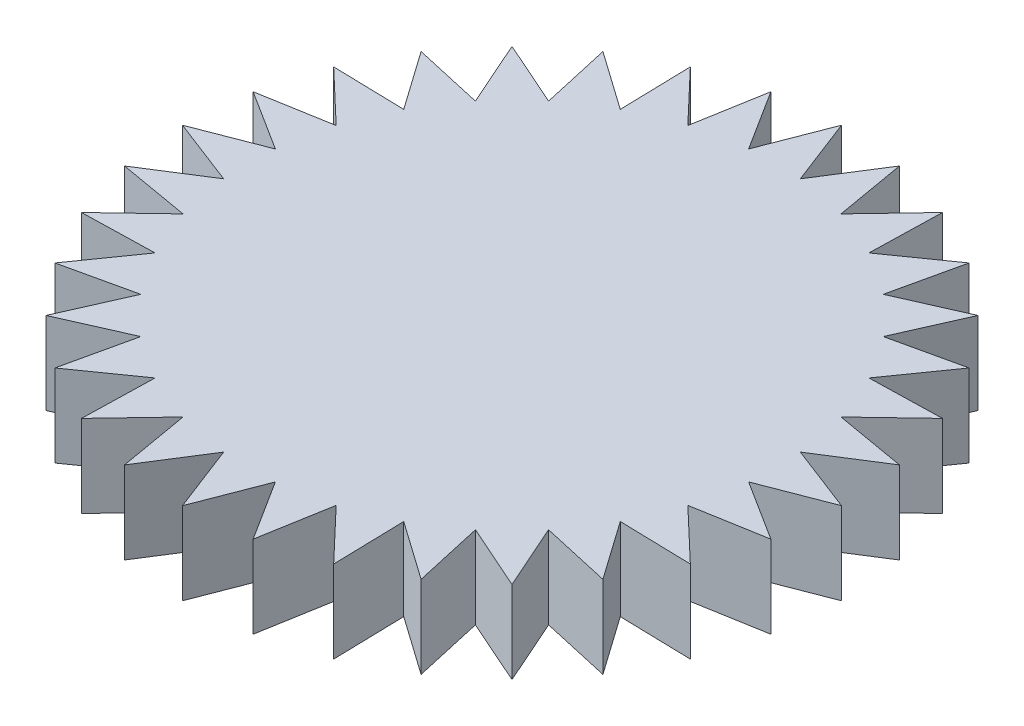
from build123d import *

# Parameters (mm, degrees)
ESQUISSE1_R             = 20
BOSS_EXTRU_1_DEPTH      = 5
ENL_V_START             = -5
ENL_V_MAT_EXTRU_1_DEPTH = 5


with BuildPart() as part:
    # Esquisse1 → Boss.-Extru.1 (new body)
    with BuildSketch(Plane(origin=(0, 0, 0), x_dir=(1, 0, 0), z_dir=(0, 1, 0))):
        with Locations(Location((0, 0, 0), (0, 0, 270))):
            Circle(ESQUISSE1_R)
    extrude(amount=BOSS_EXTRU_1_DEPTH)

    # Esquisse2 → Enlèv. mat.-Extru.1 (cut)
    with BuildSketch(Plane(origin=(0, 5, 0), x_dir=(1, 0, 0), z_dir=(0, 1, 0)).offset(ENL_V_START)):
        with BuildLine():
            Line((-4.64704136, 15.319242341), (-3.90180644, 19.615705608))
            ThreePointArc((-3.90180644, 19.615705608), (-5.805693545, 19.138806715), (-7.653668647, 18.47759065))
            Line((-7.653668647, 18.47759065), (-4.64704136, 15.319242341))
        make_face()
        with BuildLine():
            Line((-1.569113842, 15.931480191), (0, 20))
            ThreePointArc((0, 20), (-1.960342807, 19.903694533), (-3.90180644, 19.615705608))
            Line((-3.90180644, 19.615705608), (-1.569113842, 15.931480191))
        make_face()
        with BuildLine():
            ThreePointArc((3.90180644, 19.615705608), (1.960342807, 19.903694533), (0, 20))
            Line((0, 20), (1.569113842, 15.931480191))
            Line((1.569113842, 15.931480191), (3.90180644, 19.615705608))
        make_face()
        with BuildLine():
            ThreePointArc((7.653668647, 18.47759065), (5.805693545, 19.138806715), (3.90180644, 19.615705608))
            Line((3.90180644, 19.615705608), (4.64704136, 15.319242341))
            Line((4.64704136, 15.319242341), (7.653668647, 18.47759065))
        make_face()
        with BuildLine():
            ThreePointArc((11.11140466, 16.629392246), (9.427934737, 17.638425287), (7.653668647, 18.47759065))
            Line((7.653668647, 18.47759065), (7.546385684, 14.1182946))
            Line((7.546385684, 14.1182946), (11.11140466, 16.629392246))
        make_face()
        with BuildLine():
            ThreePointArc((14.142135624, 14.142135624), (12.687865683, 15.460209067), (11.11140466, 16.629392246))
            Line((11.11140466, 16.629392246), (10.155726639, 12.374788715))
            Line((10.155726639, 12.374788715), (14.142135624, 14.142135624))
        make_face()
        with BuildLine():
            ThreePointArc((16.629392246, 11.11140466), (15.460209067, 12.687865683), (14.142135624, 14.142135624))
            Line((14.142135624, 14.142135624), (12.374788715, 10.155726639))
            Line((12.374788715, 10.155726639), (16.629392246, 11.11140466))
        make_face()
        with BuildLine():
            ThreePointArc((18.47759065, 7.653668647), (17.638425287, 9.427934737), (16.629392246, 11.11140466))
            Line((16.629392246, 11.11140466), (14.1182946, 7.546385684))
            Line((14.1182946, 7.546385684), (18.47759065, 7.653668647))
        make_face()
        with BuildLine():
            ThreePointArc((19.615705608, 3.90180644), (19.138806715, 5.805693545), (18.47759065, 7.653668647))
            Line((18.47759065, 7.653668647), (15.319242341, 4.64704136))
            Line((15.319242341, 4.64704136), (19.615705608, 3.90180644))
        make_face()
        with BuildLine():
            ThreePointArc((20, 0), (19.903694533, 1.960342807), (19.615705608, 3.90180644))
            Line((19.615705608, 3.90180644), (15.931480191, 1.569113842))
            Line((15.931480191, 1.569113842), (20, 0))
        make_face()
        with BuildLine():
            ThreePointArc((19.615705608, -3.90180644), (19.903694533, -1.960342807), (20, 0))
            Line((20, 0), (15.931480191, -1.569113842))
            Line((15.931480191, -1.569113842), (19.615705608, -3.90180644))
        make_face()
        with BuildLine():
            ThreePointArc((18.47759065, -7.653668647), (19.138806715, -5.805693545), (19.615705608, -3.90180644))
            Line((19.615705608, -3.90180644), (15.319242341, -4.64704136))
            Line((15.319242341, -4.64704136), (18.47759065, -7.653668647))
        make_face()
        with BuildLine():
            Line((-7.546385684, 14.1182946), (-7.653668647, 18.47759065))
            ThreePointArc((-7.653668647, 18.47759065), (-9.427934737, 17.638425287), (-11.11140466, 16.629392246))
            Line((-11.11140466, 16.629392246), (-7.546385684, 14.1182946))
        make_face()
        with BuildLine():
            Line((-10.155726639, 12.374788715), (-11.11140466, 16.629392246))
            ThreePointArc((-11.11140466, 16.629392246), (-12.687865683, 15.460209067), (-14.142135624, 14.142135624))
            Line((-14.142135624, 14.142135624), (-10.155726639, 12.374788715))
        make_face()
        with BuildLine():
            Line((-12.374788715, 10.155726639), (-14.142135624, 14.142135624))
            ThreePointArc((-14.142135624, 14.142135624), (-15.460209067, 12.687865683), (-16.629392246, 11.11140466))
            Line((-16.629392246, 11.11140466), (-12.374788715, 10.155726639))
        make_face()
        with BuildLine():
            Line((-14.1182946, 7.546385684), (-16.629392246, 11.11140466))
            ThreePointArc((-16.629392246, 11.11140466), (-17.638425287, 9.427934737), (-18.47759065, 7.653668647))
            Line((-18.47759065, 7.653668647), (-14.1182946, 7.546385684))
        make_face()
        with BuildLine():
            Line((-15.319242341, 4.64704136), (-18.47759065, 7.653668647))
            ThreePointArc((-18.47759065, 7.653668647), (-19.138806715, 5.805693545), (-19.615705608, 3.90180644))
            Line((-19.615705608, 3.90180644), (-15.319242341, 4.64704136))
        make_face()
        with BuildLine():
            Line((-15.931480191, 1.569113842), (-19.615705608, 3.90180644))
            ThreePointArc((-19.615705608, 3.90180644), (-19.903694533, 1.960342807), (-20, 0))
            Line((-20, 0), (-15.931480191, 1.569113842))
        make_face()
        with BuildLine():
            Line((-15.931480191, -1.569113842), (-20, 0))
            ThreePointArc((-20, 0), (-19.903694533, -1.960342807), (-19.615705608, -3.90180644))
            Line((-19.615705608, -3.90180644), (-15.931480191, -1.569113842))
        make_face()
        with BuildLine():
            Line((-15.319242341, -4.64704136), (-19.615705608, -3.90180644))
            ThreePointArc((-19.615705608, -3.90180644), (-19.138806715, -5.805693545), (-18.47759065, -7.653668647))
            Line((-18.47759065, -7.653668647), (-15.319242341, -4.64704136))
        make_face()
        with BuildLine():
            Line((-14.1182946, -7.546385684), (-18.47759065, -7.653668647))
            ThreePointArc((-18.47759065, -7.653668647), (-17.638425287, -9.427934737), (-16.629392246, -11.11140466))
            Line((-16.629392246, -11.11140466), (-14.1182946, -7.546385684))
        make_face()
        with BuildLine():
            Line((-12.374788715, -10.155726639), (-16.629392246, -11.11140466))
            ThreePointArc((-16.629392246, -11.11140466), (-15.460209067, -12.687865683), (-14.142135624, -14.142135624))
            Line((-14.142135624, -14.142135624), (-12.374788715, -10.155726639))
        make_face()
        with BuildLine():
            Line((-10.155726639, -12.374788715), (-14.142135624, -14.142135624))
            ThreePointArc((-14.142135624, -14.142135624), (-12.687865683, -15.460209067), (-11.11140466, -16.629392246))
            Line((-11.11140466, -16.629392246), (-10.155726639, -12.374788715))
        make_face()
        with BuildLine():
            Line((-7.546385684, -14.1182946), (-11.11140466, -16.629392246))
            ThreePointArc((-11.11140466, -16.629392246), (-9.427934737, -17.638425287), (-7.653668647, -18.47759065))
            Line((-7.653668647, -18.47759065), (-7.546385684, -14.1182946))
        make_face()
        with BuildLine():
            Line((-4.64704136, -15.319242341), (-7.653668647, -18.47759065))
            ThreePointArc((-7.653668647, -18.47759065), (-5.805693545, -19.138806715), (-3.90180644, -19.615705608))
            Line((-3.90180644, -19.615705608), (-4.64704136, -15.319242341))
        make_face()
        with BuildLine():
            Line((-1.569113842, -15.931480191), (-3.90180644, -19.615705608))
            ThreePointArc((-3.90180644, -19.615705608), (-1.960342807, -19.903694533), (0, -20))
            Line((0, -20), (-1.569113842, -15.931480191))
        make_face()
        with BuildLine():
            ThreePointArc((0, -20), (1.960342807, -19.903694533), (3.90180644, -19.615705608))
            Line((3.90180644, -19.615705608), (1.569113842, -15.931480191))
            Line((1.569113842, -15.931480191), (0, -20))
        make_face()
        with BuildLine():
            ThreePointArc((3.90180644, -19.615705608), (5.805693545, -19.138806715), (7.653668647, -18.47759065))
            Line((7.653668647, -18.47759065), (4.64704136, -15.319242341))
            Line((4.64704136, -15.319242341), (3.90180644, -19.615705608))
        make_face()
        with BuildLine():
            ThreePointArc((7.653668647, -18.47759065), (9.427934737, -17.638425287), (11.11140466, -16.629392246))
            Line((11.11140466, -16.629392246), (7.546385684, -14.1182946))
            Line((7.546385684, -14.1182946), (7.653668647, -18.47759065))
        make_face()
        with BuildLine():
            ThreePointArc((11.11140466, -16.629392246), (12.687865683, -15.460209067), (14.142135624, -14.142135624))
            Line((14.142135624, -14.142135624), (10.155726639, -12.374788715))
            Line((10.155726639, -12.374788715), (11.11140466, -16.629392246))
        make_face()
        with BuildLine():
            ThreePointArc((14.142135624, -14.142135624), (15.460209067, -12.687865683), (16.629392246, -11.11140466))
            Line((16.629392246, -11.11140466), (12.374788715, -10.155726639))
            Line((12.374788715, -10.155726639), (14.142135624, -14.142135624))
        make_face()
        with BuildLine():
            ThreePointArc((16.629392246, -11.11140466), (17.638425287, -9.427934737), (18.47759065, -7.653668647))
            Line((18.47759065, -7.653668647), (14.1182946, -7.546385684))
            Line((14.1182946, -7.546385684), (16.629392246, -11.11140466))
        make_face()
    extrude(amount=ENL_V_MAT_EXTRU_1_DEPTH, mode=Mode.SUBTRACT)


solid = part.part
